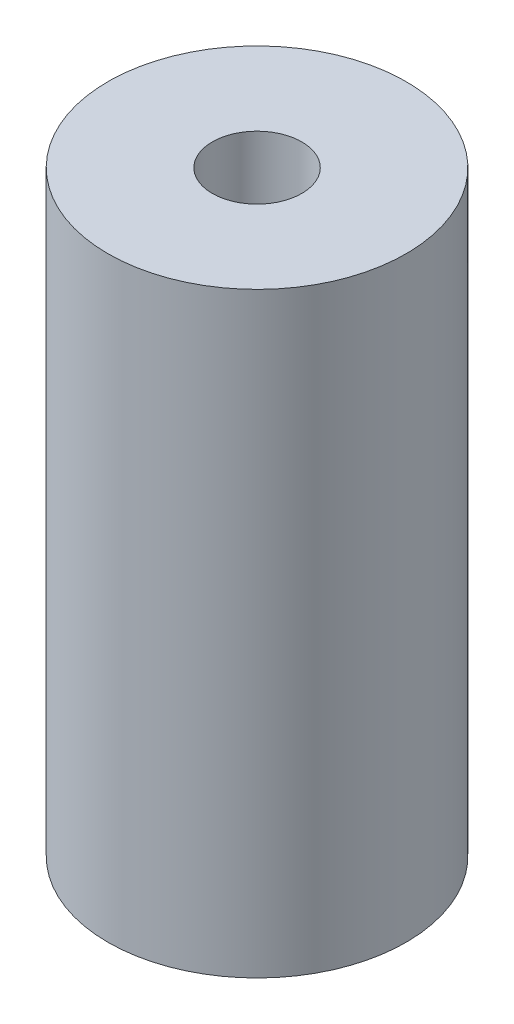
from build123d import *

# Parameters (mm, degrees)
SKETCH1_R           = 5
SKETCH1_R_2         = 1.5
BOSS_EXTRUDE1_DEPTH = 20


with BuildPart() as part:
    # Sketch1 → Boss-Extrude1 (new body)
    with BuildSketch(Plane(origin=(0, 0, 0), x_dir=(1, 0, 0), z_dir=(0, 1, 0))):
        with Locations(Location((0, 0, 0), (0, 0, 270))):
            Circle(SKETCH1_R)
        with Locations(Location((0, 0, 0), (0, 0, 270))):
            Circle(SKETCH1_R_2, mode=Mode.SUBTRACT)
    extrude(amount=BOSS_EXTRUDE1_DEPTH)


solid = part.part
